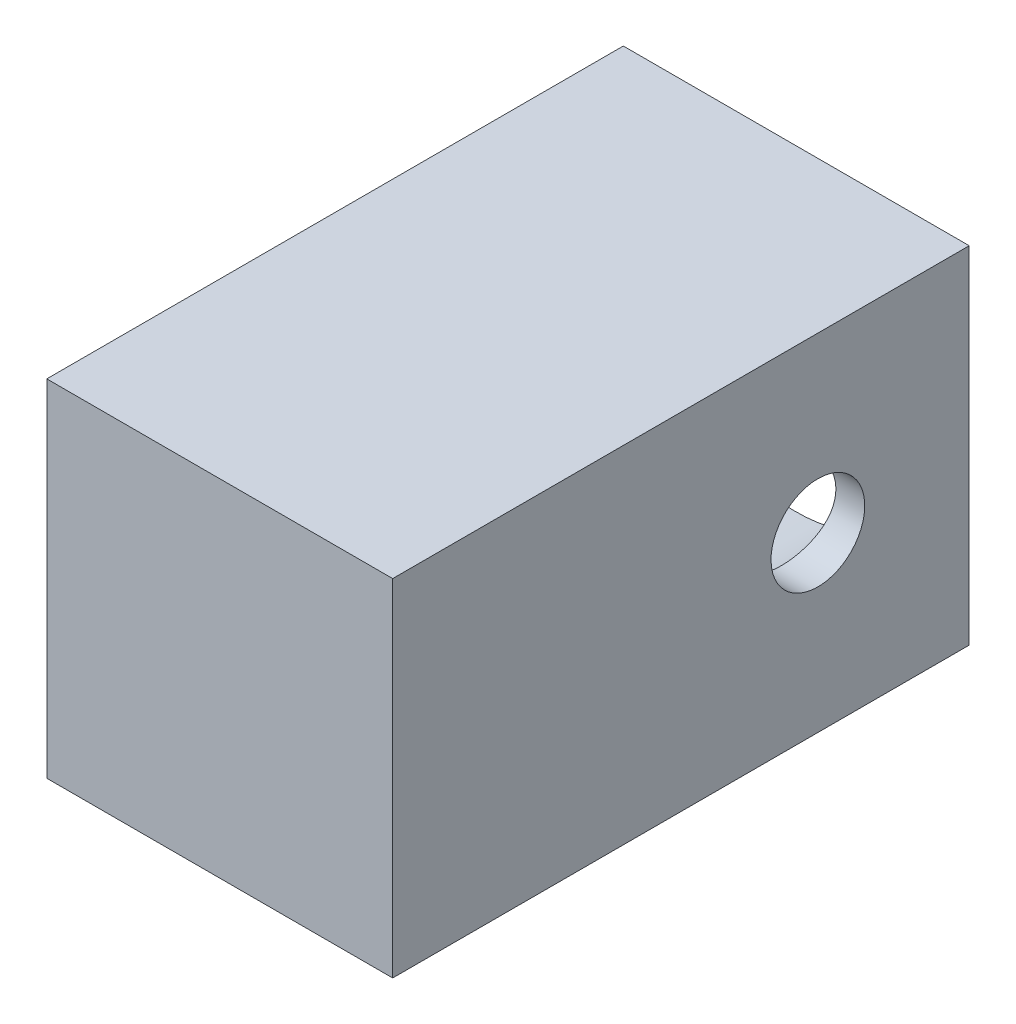
from build123d import *

# Parameters (mm, degrees)
SKETCH_3_W          = 24
SKETCH_3_H          = 24
EXTRUDE_1_DEPTH     = 20
CUT_EXTRUDE_1_REACH = 28.23
SKETCH_4_R          = 10
SKETCH_6_W          = 24
SKETCH_6_H          = 24
EXTRUDE_2_DEPTH     = 20
SKETCH_8_R          = 3.25
CUT_EXTRUDE_2_DEPTH = 54.677075735


with BuildPart() as part:
    # 草图3 → 凸台-拉伸1 (new body)
    with BuildSketch(Plane.XY.offset(26.489014396)):
        Rectangle(SKETCH_3_W, SKETCH_3_H)
    extrude(amount=-EXTRUDE_1_DEPTH)

    # 草图4 → 切除-拉伸1 (cut, up to next)
    with BuildSketch(Plane(origin=(0, 0, 6.489014396), x_dir=(-1, 0, 0), z_dir=(0, 0, -1)), mode=Mode.PRIVATE) as cut_extrude_1_sk1:
        Circle(SKETCH_4_R)
    cut_extrude_1_tool1 = extrude(cut_extrude_1_sk1.sketch, amount=-CUT_EXTRUDE_1_REACH, mode=Mode.PRIVATE) & part.part
    add(cut_extrude_1_tool1.solids().sort_by_distance((0, 0, 6.489014))[0], mode=Mode.SUBTRACT)

    # 草图6 → 凸台-拉伸2 (add)
    with BuildSketch(Plane.XY.offset(26.489014396)):
        Rectangle(SKETCH_6_W, SKETCH_6_H)
    extrude(amount=EXTRUDE_2_DEPTH)

    # 草图8 → 切除-拉伸2 (cut, through all)
    with BuildSketch(Plane(origin=(12, 0, 0), x_dir=(0, 0, -1), z_dir=(1, 0, 0))):
        with Locations(Location((-16.989014396, 0, 0), (0, 0, 90))):
            Circle(SKETCH_8_R)
    extrude(amount=-CUT_EXTRUDE_2_DEPTH, mode=Mode.SUBTRACT)


solid = part.part
